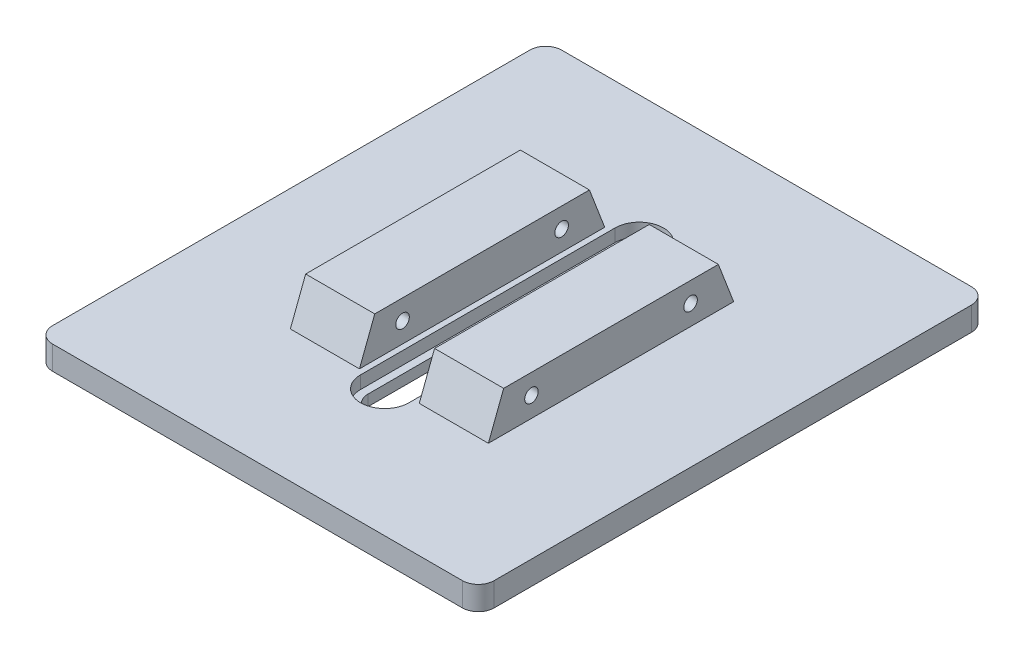
from build123d import *

# Parameters (mm, degrees)
SKETCH1_W             = 88.138
SKETCH1_H             = 101.6
BOSS_EXTRUDE1_DEPTH   = 12.7
SKETCH2_W             = 24.3078
SKETCH2_H             = 101.6
SKETCH2_W_2           = 11.938
CUT_EXTRUDE1_DEPTH    = 7.9756
CUT_EXTRUDE2_DEPTH    = 102.139918983
CUT_EXTRUDE3_DEPTH    = 2.54
F_6_32_TAPPED_HOLE1_D = 2.7051
FILLET1_R             = 3.175
CUT_EXTRUDE4_DEPTH    = 105.220067893


with BuildPart() as part:
    # Sketch1 → Boss-Extrude1 (new body)
    with BuildSketch(Plane(origin=(0, 0, 0), x_dir=(1, 0, 0), z_dir=(0, 1, 0))):
        with Locations((-15.42415, 30.601708333)):
            Rectangle(SKETCH1_W, SKETCH1_H)
    extrude(amount=BOSS_EXTRUDE1_DEPTH)

    # Sketch2 → Cut-Extrude1 (cut)
    with BuildSketch(Plane(origin=(0, 12.7, 0), x_dir=(1, 0, 0), z_dir=(0, 1, 0))):
        with Locations((-47.33925, 30.601708333)):
            Rectangle(SKETCH2_W, SKETCH2_H)
        with Locations((16.49095, 30.601708333)):
            Rectangle(SKETCH2_W, SKETCH2_H)
        with Locations((-15.42415, 30.601708333)):
            Rectangle(SKETCH2_W_2, SKETCH2_H)
    extrude(amount=-CUT_EXTRUDE1_DEPTH, mode=Mode.SUBTRACT)

    # Sketch3 → Cut-Extrude2 (cut, through all)
    with BuildSketch(Plane(origin=(0, 4.7244, 0), x_dir=(1, 0, 0), z_dir=(0, 1, 0))):
        with BuildLine():
            Line((-18.72615, 5.201708333), (-18.72615, 56.001708333))
            ThreePointArc((-18.72615, 56.001708333), (-15.42415, 59.303708333), (-12.12215, 56.001708333))
            Line((-12.12215, 56.001708333), (-12.12215, 5.201708333))
            ThreePointArc((-12.12215, 5.201708333), (-15.42415, 1.899708333), (-18.72615, 5.201708333))
        make_face()
    extrude(amount=-CUT_EXTRUDE2_DEPTH, mode=Mode.SUBTRACT)

    # Sketch4 → Cut-Extrude3 (cut)
    with BuildSketch(Plane(origin=(0, 4.7244, 0), x_dir=(1, 0, 0), z_dir=(0, 1, 0))):
        with BuildLine():
            Line((-20.25015, 5.201708333), (-20.25015, 56.001708333))
            ThreePointArc((-20.25015, 56.001708333), (-15.42415, 60.827708333), (-10.59815, 56.001708333))
            Line((-10.59815, 56.001708333), (-10.59815, 5.201708333))
            ThreePointArc((-10.59815, 5.201708333), (-15.42415, 0.375708333), (-20.25015, 5.201708333))
        make_face()
    extrude(amount=-CUT_EXTRUDE3_DEPTH, mode=Mode.SUBTRACT)

    # #6-32 Tapped Hole1 (through all)
    with Locations(Plane(origin=(4.33705, 0, 0), x_dir=(0, 0, -1), z_dir=(1, 0, 0))):
        with Locations((14.726708333, 8.7122), (46.476708333, 8.7122)):
            Hole(F_6_32_TAPPED_HOLE1_D / 2)

    # Fillet1
    fillet1_edges = [part.edges().sort_by_distance(p)[0] for p in [
        (-59.49315, 2.3622, -81.401708333),
        (-59.49315, 2.3622, 20.198291667),
        (28.64485, 2.3622, -81.401708333),
        (28.64485, 2.3622, 20.198291667),
    ]]
    fillet(fillet1_edges, radius=FILLET1_R)

    # Sketch8 → Cut-Extrude4 (cut, through all)
    with BuildSketch(Plane.ZY.offset(35.18535)):
        Polygon((-6.128808333, 4.7244), (-9.206801398, 12.7762), (20.198291667, 12.7), (20.198291667, 4.7244), align=None)
        Polygon((-55.074608333, 4.7244), (-51.996615269, 12.7762), (-81.401708333, 12.7), (-81.401708333, 4.7244), align=None)
    extrude(amount=-CUT_EXTRUDE4_DEPTH, mode=Mode.SUBTRACT)


solid = part.part
